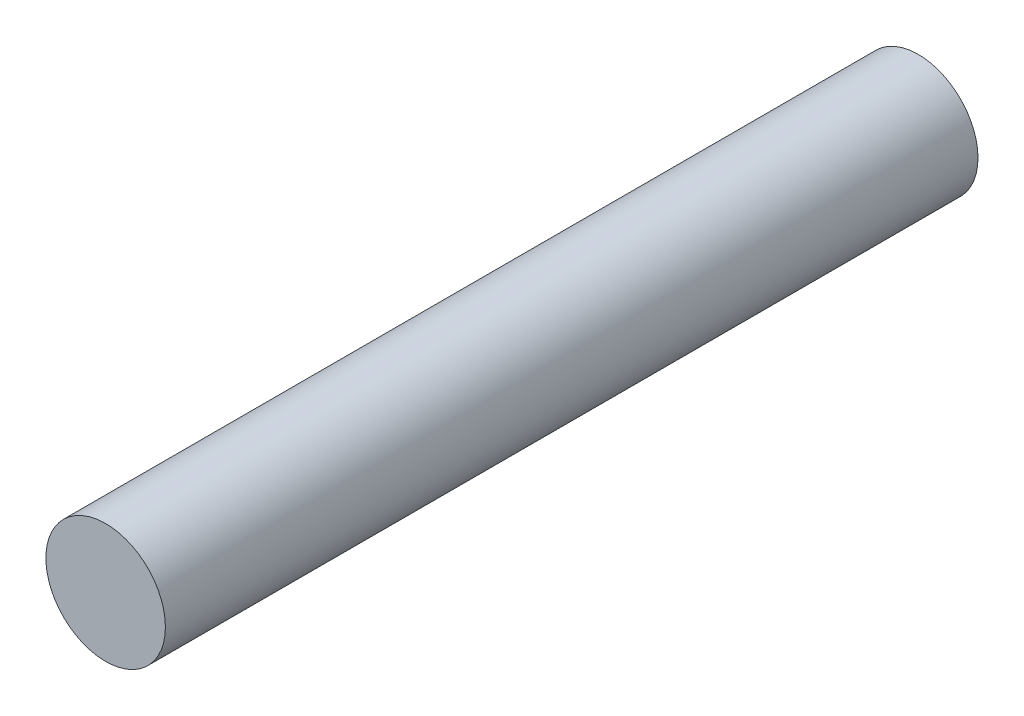
from build123d import *

# Parameters (mm, degrees)
SKETCH1_R           = 2.5
BOSS_EXTRUDE1_DEPTH = 34


with BuildPart() as part:
    # Sketch1 → Boss-Extrude1 (new body)
    with BuildSketch(Plane.XY):
        with Locations((-40.983162755, 47.501201816)):
            Circle(SKETCH1_R)
    extrude(amount=BOSS_EXTRUDE1_DEPTH)


solid = part.part
